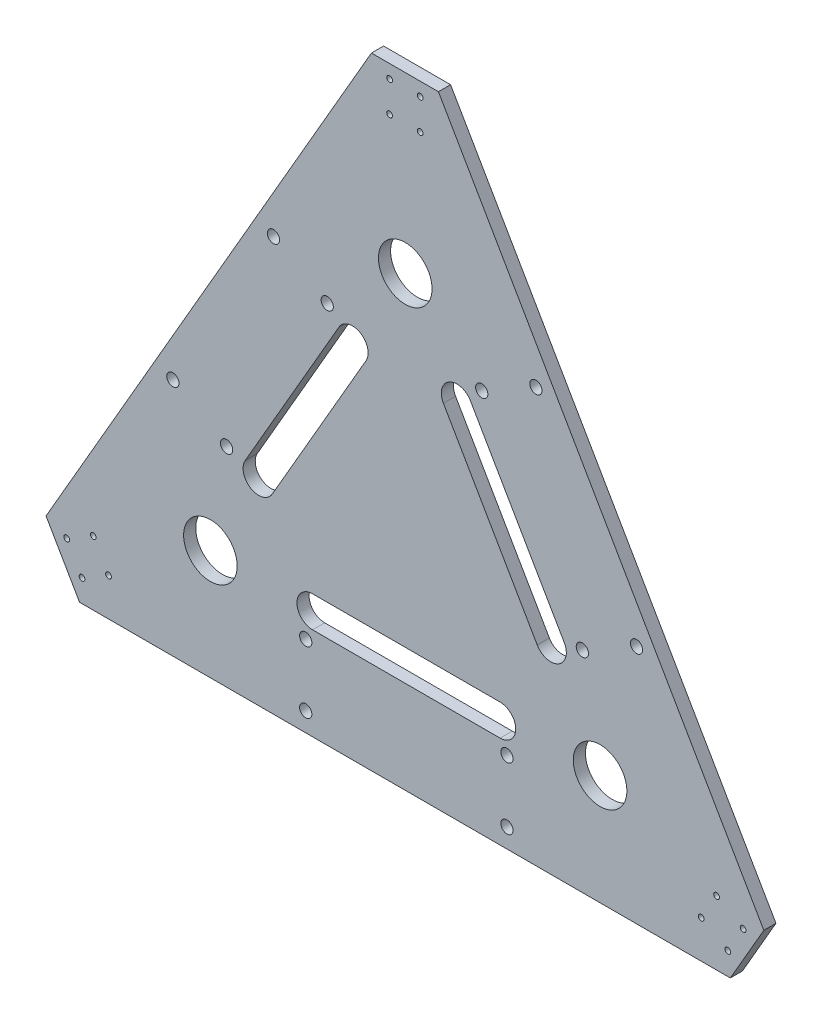
from build123d import *

# Parameters (mm, degrees)
SKETCH1_R           = 3.2
SKETCH1_R_2         = 14
BOSS_EXTRUDE1_DEPTH = 6.35
SKETCH2_R           = 1.5
CUT_EXTRUDE1_DEPTH  = 736.05148275


with BuildPart() as part:
    # Sketch1 → Boss-Extrude1 (new body)
    with BuildSketch(Plane.XY):
        Polygon((-647.460250444, -317.619540534), (-477.475995614, -23.198174681), (-442.475995614, -23.198174681), (-272.491740783, -317.619540534), (-289.991740783, -347.930429667), (-629.960250444, -347.930429667), align=None)
        with Locations((-581.209182953, -222.869325584)):
            Circle(SKETCH1_R, mode=Mode.SUBTRACT)
        with Locations((-528.649182953, -131.832735139)):
            Circle(SKETCH1_R, mode=Mode.SUBTRACT)
        with Locations((-500.577727615, -148.011529753)):
            Circle(SKETCH1_R, mode=Mode.SUBTRACT)
        with Locations((-553.136815613, -239.046537702)):
            Circle(SKETCH1_R, mode=Mode.SUBTRACT)
        with Locations((-367.294158494, -238.209054553)):
            Circle(SKETCH1_R, mode=Mode.SUBTRACT)
        with Locations((-419.854158494, -147.172464107)):
            Circle(SKETCH1_R, mode=Mode.SUBTRACT)
        with Locations((-391.545684719, -131.412060795)):
            Circle(SKETCH1_R, mode=Mode.SUBTRACT)
        with Locations((-338.985684719, -222.448651241)):
            Circle(SKETCH1_R, mode=Mode.SUBTRACT)
        with Locations((-511.800751787, -305.530429667)):
            Circle(SKETCH1_R, mode=Mode.SUBTRACT)
        with Locations((-406.680508256, -305.530429667)):
            Circle(SKETCH1_R, mode=Mode.SUBTRACT)
        with Locations((-406.680630022, -337.930429667)):
            Circle(SKETCH1_R, mode=Mode.SUBTRACT)
        with Locations((-511.800630022, -337.930429667)):
            Circle(SKETCH1_R, mode=Mode.SUBTRACT)
        with Locations((-459.807870528, -114.054080446)):
            Circle(SKETCH1_R_2, mode=Mode.SUBTRACT)
        with Locations((-358.022290508, -290.351876517)):
            Circle(SKETCH1_R_2, mode=Mode.SUBTRACT)
        with Locations((-561.593450547, -290.351876517)):
            Circle(SKETCH1_R_2, mode=Mode.SUBTRACT)
        with BuildLine():
            Line((-425.750841471, -154.687649698), (-376.750841471, -239.558139269))
            ThreePointArc((-376.750841471, -239.558139269), (-379.734271663, -250.692452327), (-390.86858472, -247.709022135))
            Line((-390.86858472, -247.709022135), (-439.86858472, -162.838532564))
            ThreePointArc((-439.86858472, -162.838532564), (-436.885154528, -151.704219506), (-425.750841471, -154.687649698))
        make_face(mode=Mode.SUBTRACT)
        with BuildLine():
            Line((-410.240508256, -299.529344232), (-508.240508256, -299.529344232))
            ThreePointArc((-508.240508256, -299.529344232), (-516.391391121, -291.378461367), (-508.240508256, -283.227578501))
            Line((-508.240508256, -283.227578501), (-410.240508256, -283.227578501))
            ThreePointArc((-410.240508256, -283.227578501), (-402.089625391, -291.378461367), (-410.240508256, -299.529344232))
        make_face(mode=Mode.SUBTRACT)
        with BuildLine():
            Line((-543.432261857, -240.54083955), (-494.432261857, -155.67034998))
            ThreePointArc((-494.432261857, -155.67034998), (-483.297948799, -152.686919788), (-480.314518607, -163.821232845))
            Line((-480.314518607, -163.821232845), (-529.314518607, -248.691722416))
            ThreePointArc((-529.314518607, -248.691722416), (-540.448831665, -251.675152608), (-543.432261857, -240.54083955))
        make_face(mode=Mode.SUBTRACT)
    extrude(amount=BOSS_EXTRUDE1_DEPTH)

    # Sketch2 → Cut-Extrude1 (cut, through all)
    with BuildSketch(Plane.XY):
        with Locations((-451.975995614, -46.198174681)):
            Circle(SKETCH2_R)
        with Locations((-291.308942687, -336.211907881)):
            Circle(SKETCH2_R)
        with Locations((-467.975995614, -30.198174681)):
            Circle(SKETCH2_R)
        with Locations((-451.975995614, -30.198174681)):
            Circle(SKETCH2_R)
        with Locations((-467.975995614, -46.198174681)):
            Circle(SKETCH2_R)
        with Locations((-283.308957903, -322.355492635)):
            Circle(SKETCH2_R)
        with Locations((-297.163015743, -314.351426082)):
            Circle(SKETCH2_R)
        with Locations((-305.165363337, -328.211898695)):
            Circle(SKETCH2_R)
        with Locations((-614.791666157, -328.203188331)):
            Circle(SKETCH2_R)
        with Locations((-622.791666157, -314.34678187)):
            Circle(SKETCH2_R)
        with Locations((-628.648072618, -336.203188331)):
            Circle(SKETCH2_R)
        with Locations((-636.648072618, -322.34678187)):
            Circle(SKETCH2_R)
    extrude(amount=CUT_EXTRUDE1_DEPTH, mode=Mode.SUBTRACT)


solid = part.part
